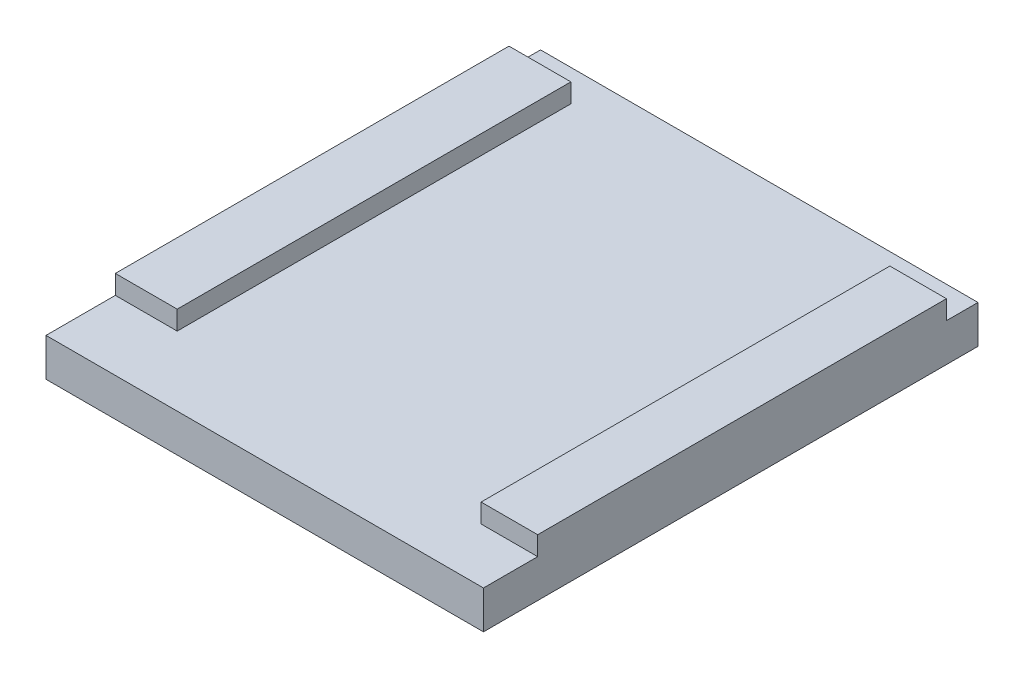
from build123d import *

# Parameters (mm, degrees)
SKETCH1_W           = 23
SKETCH1_H           = 26
BOSS_EXTRUDE1_DEPTH = 2
SKETCH2_W           = 3.253983471
SKETCH2_H           = 20.696800695
SKETCH2_W_2         = 2.973665628
SKETCH2_H_2         = 21.491034581
BOSS_EXTRUDE2_DEPTH = 1


with BuildPart() as part:
    # Sketch1 → Boss-Extrude1 (new body)
    with BuildSketch(Plane(origin=(0, 0, 0), x_dir=(1, 0, 0), z_dir=(0, 1, 0))):
        with Locations((11.5, -13)):
            Rectangle(SKETCH1_W, SKETCH1_H)
    extrude(amount=BOSS_EXTRUDE1_DEPTH)

    # Sketch2 → Boss-Extrude2 (add)
    with BuildSketch(Plane(origin=(0, 2, 0), x_dir=(1, 0, 0), z_dir=(0, 1, 0))):
        with Locations((1.626991736, -12.007207642)):
            Rectangle(SKETCH2_W, SKETCH2_H)
        with Locations((21.513167186, -12.404324584)):
            Rectangle(SKETCH2_W_2, SKETCH2_H_2)
    extrude(amount=BOSS_EXTRUDE2_DEPTH)


solid = part.part
